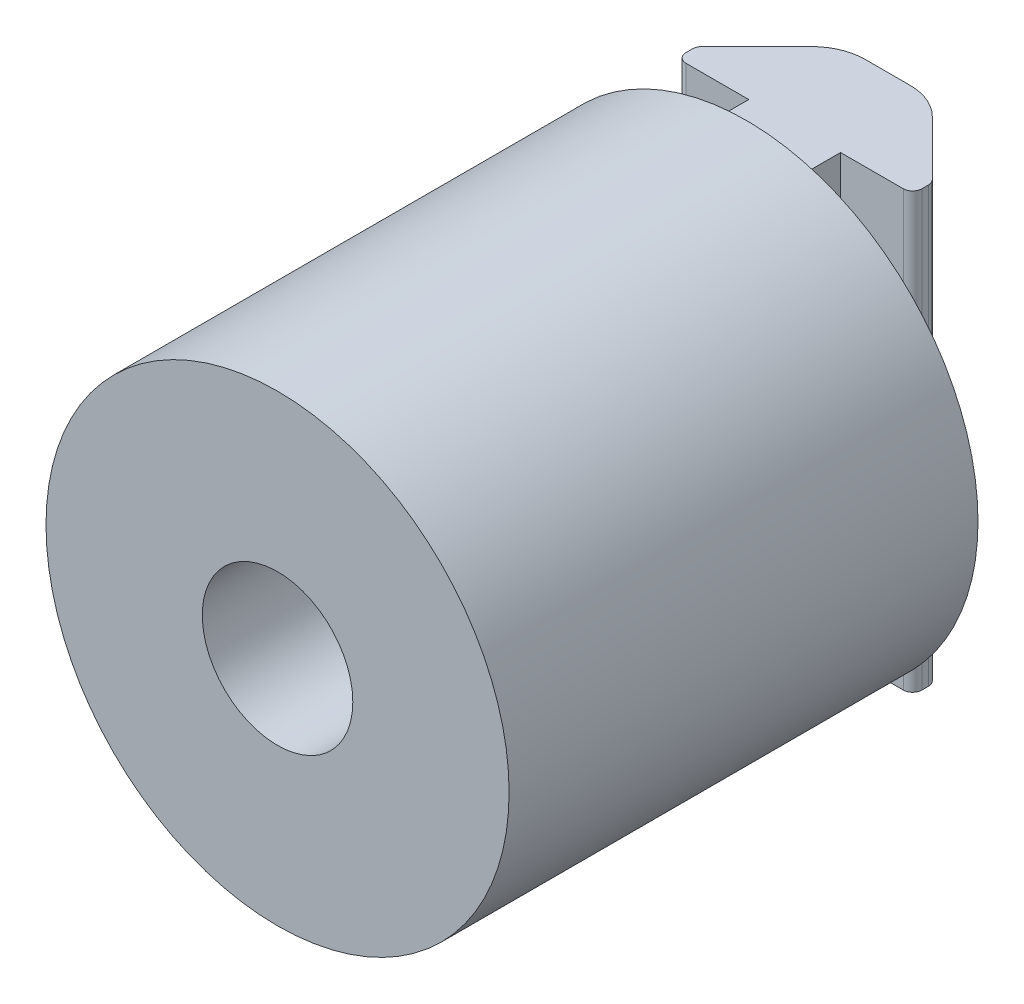
from build123d import *

# Parameters (mm, degrees)
BOSS_EXTRUDE1_DEPTH      = 17.5
BOSS_EXTRUDE1_DEPTH_BACK = 20
BOSS_EXTRUDE2_DEPTH      = 5
BOSS_EXTRUDE2_DEPTH_BACK = 5
SKETCH4_R                = 20
BOSS_EXTRUDE3_START      = 10.5
SKETCH5_R                = 20
SKETCH5_R_2              = 12.5
BOSS_EXTRUDE3_DEPTH      = 10.5
BOSS_EXTRUDE4_START      = 20
SKETCH6_R                = 20
SKETCH6_R_2              = 6.5
BOSS_EXTRUDE4_DEPTH      = 20


with BuildPart() as part:
    # Sketch3 → Boss-Extrude1 (new, two sides: drawn at the far end of the back side and taken through both)
    with BuildSketch(Plane(origin=(0, 0, 0), x_dir=(1, 0, 0), z_dir=(0, 1, 0)).offset(-BOSS_EXTRUDE1_DEPTH_BACK)):
        with BuildLine():
            Line((-9.385342517, 4.164), (-5.617617549, 4.164))
            Line((-5.617617549, 4.164), (-3.964, 4.164))
            Line((-3.964, 4.164), (-3.964, 2.510382451))
            Line((-3.964, 2.510382451), (-3.964, 1.553617549))
            Line((-3.964, 1.553617549), (-3.964, -0.1))
            Line((-3.964, -0.1), (3.964, -0.1))
            Line((3.964, -0.1), (3.964, 1.553617549))
            Line((3.964, 1.553617549), (3.964, 2.510382451))
            Line((3.964, 2.510382451), (3.964, 4.164))
            Line((3.964, 4.164), (5.617617549, 4.164))
            Line((5.617617549, 4.164), (9.385342517, 4.164))
            ThreePointArc((9.385342517, 4.164), (9.952230024, 4.398812494), (10.187042517, 4.9657))
            Line((10.187042517, 4.9657), (10.187042517, 5.533957912))
            ThreePointArc((10.187042517, 5.533957912), (10.12601655, 5.840755675), (9.952229326, 6.100846116))
            Line((9.952229326, 6.100846116), (5.221354652, 10.831709155))
            ThreePointArc((5.221354652, 10.831709155), (3.712852366, 11.839656144), (1.933453584, 12.1936))
            Line((1.933453584, 12.1936), (-1.933453584, 12.1936))
            ThreePointArc((-1.933453584, 12.1936), (-3.712852366, 11.839656144), (-5.221354652, 10.831709155))
            Line((-5.221354652, 10.831709155), (-9.952229326, 6.100846116))
            ThreePointArc((-9.952229326, 6.100846116), (-10.12601655, 5.840755675), (-10.187042517, 5.533957912))
            Line((-10.187042517, 5.533957912), (-10.187042517, 4.9657))
            ThreePointArc((-10.187042517, 4.9657), (-9.952230024, 4.398812494), (-9.385342517, 4.164))
        make_face()
    extrude(amount=BOSS_EXTRUDE1_DEPTH + BOSS_EXTRUDE1_DEPTH_BACK)

    # Sketch4 → Boss-Extrude2 (add, two sides: drawn at the far end of the back side and taken through both)
    with BuildSketch(Plane.XY.offset(5).offset(-BOSS_EXTRUDE2_DEPTH_BACK)):
        Circle(SKETCH4_R)
    extrude(amount=BOSS_EXTRUDE2_DEPTH + BOSS_EXTRUDE2_DEPTH_BACK)

    # Sketch5 → Boss-Extrude3 (add)
    with BuildSketch(Plane.XY.offset(10).offset(BOSS_EXTRUDE3_START)):
        Circle(SKETCH5_R)
        with Locations(Location((0, 0, 0), (0, 0, 180))):
            Circle(SKETCH5_R_2, mode=Mode.SUBTRACT)
    extrude(amount=-BOSS_EXTRUDE3_DEPTH)

    # Sketch6 → Boss-Extrude4 (add)
    with BuildSketch(Plane.XY.offset(20.5).offset(BOSS_EXTRUDE4_START)):
        Circle(SKETCH6_R)
        Circle(SKETCH6_R_2, mode=Mode.SUBTRACT)
    extrude(amount=-BOSS_EXTRUDE4_DEPTH)


solid = part.part
